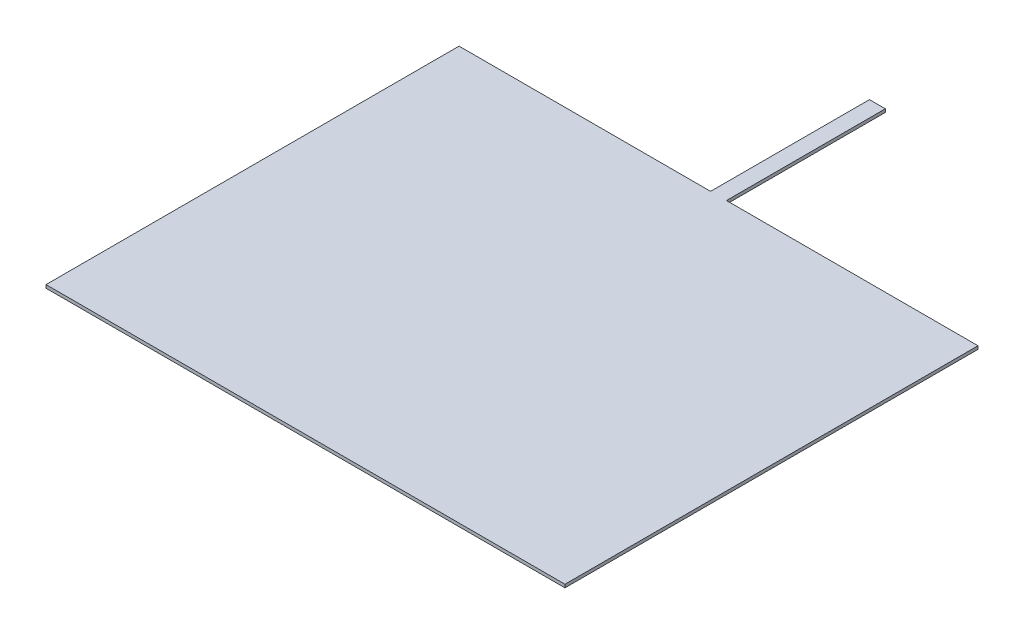
from build123d import *

# Parameters (mm, degrees)
SKETCH_1_W      = 3
SKETCH_1_H      = 30
EXTRUDE_1_DEPTH = 0.6


with BuildPart() as part:
    # Эскиз1 → Бобышка-Вытянуть1 (new body)
    with BuildSketch(Plane(origin=(0, 0, 0), x_dir=(1, 0, 0), z_dir=(0, 1, 0))):
        Polygon((0, 78), (0, 0), (98, 0), (98, 78), (50.5, 78), (50.5, 48), (47.5, 48), (47.5, 78), align=None)
        with Locations((49, 93)):
            Rectangle(SKETCH_1_W, SKETCH_1_H)
        with Locations((49, 63)):
            Rectangle(SKETCH_1_W, SKETCH_1_H)
    extrude(amount=EXTRUDE_1_DEPTH)


solid = part.part
